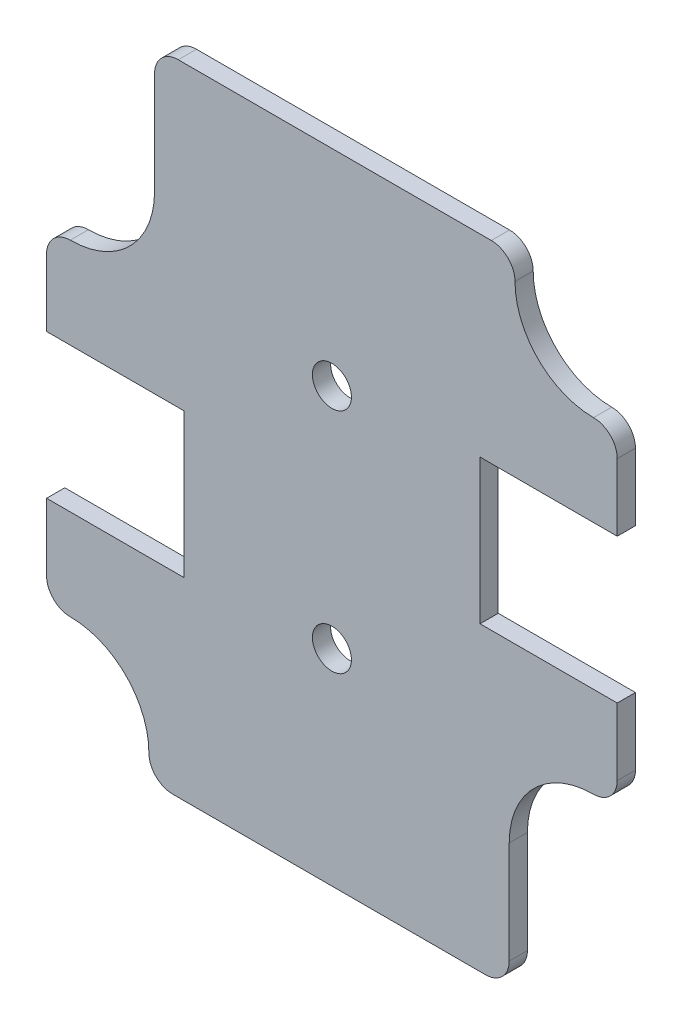
from build123d import *

# Parameters (mm, degrees)
SKETCH2_R           = 1.7145
BOSS_EXTRUDE1_DEPTH = 1.6002


with BuildPart() as part:
    # Sketch2 → Boss-Extrude1 (new body)
    with BuildSketch(Plane.XY):
        with BuildLine():
            Line((38.6072, 0), (11.082800196, 1.7681e-05))
            ThreePointArc((11.082800196, 1.7681e-05), (9.606488401, 0.61865036), (9.000017681, 2.099999804))
            ThreePointArc((9.000017681, 2.099999804), (6.97904829, 6.979042972), (2.099999804, 9.000017681))
            ThreePointArc((2.099999804, 9.000017681), (0.61865036, 9.606488401), (1.7681e-05, 11.082800196))
            Line((1.7681e-05, 11.082800196), (0, 16.9926))
            Line((0, 16.9926), (12.065, 16.9926))
            Line((12.065, 16.9926), (12.065, 29.6926))
            Line((12.065, 29.6926), (0, 29.6926))
            Line((0, 29.6926), (1e-08, 35.607199954))
            ThreePointArc((1e-08, 35.607199954), (0.61023797, 37.080044807), (2.083199954, 37.68999999))
            ThreePointArc((2.083199954, 37.68999999), (7.327669562, 39.862330403), (9.5, 45.1068))
            Line((9.5, 45.1068), (9.5, 54.102))
            ThreePointArc((9.5, 54.102), (10.110037996, 55.574762004), (11.5828, 56.1848))
            Line((11.5828, 56.1848), (39.116, 56.1848))
            ThreePointArc((39.116, 56.1848), (40.588762004, 55.574762004), (41.1988, 54.102))
            ThreePointArc((41.1988, 54.102), (43.220399728, 49.21262534), (48.107196234, 47.184801403))
            ThreePointArc((48.107196234, 47.184801403), (49.579961168, 46.574764242), (50.19, 45.102))
            Line((50.19, 45.102), (50.19, 39.1922))
            Line((50.19, 39.1922), (38.125, 39.1922))
            Line((38.125, 39.1922), (38.125, 26.4922))
            Line((38.125, 26.4922), (50.19, 26.4922))
            Line((50.19, 26.4922), (50.18999999, 20.582800046))
            ThreePointArc((50.18999999, 20.582800046), (49.57976203, 19.109955193), (48.106800046, 18.50000001))
            ThreePointArc((48.106800046, 18.50000001), (42.862330438, 16.327669597), (40.69, 11.0832))
            Line((40.69, 11.0832), (40.69, 2.0828))
            ThreePointArc((40.69, 2.0828), (40.079962004, 0.610037996), (38.6072, 0))
        make_face()
        with Locations((25.0952, 38.1)):
            Circle(SKETCH2_R, mode=Mode.SUBTRACT)
        with Locations((25.0952, 18.0848)):
            Circle(SKETCH2_R, mode=Mode.SUBTRACT)
    extrude(amount=BOSS_EXTRUDE1_DEPTH)


solid = part.part
